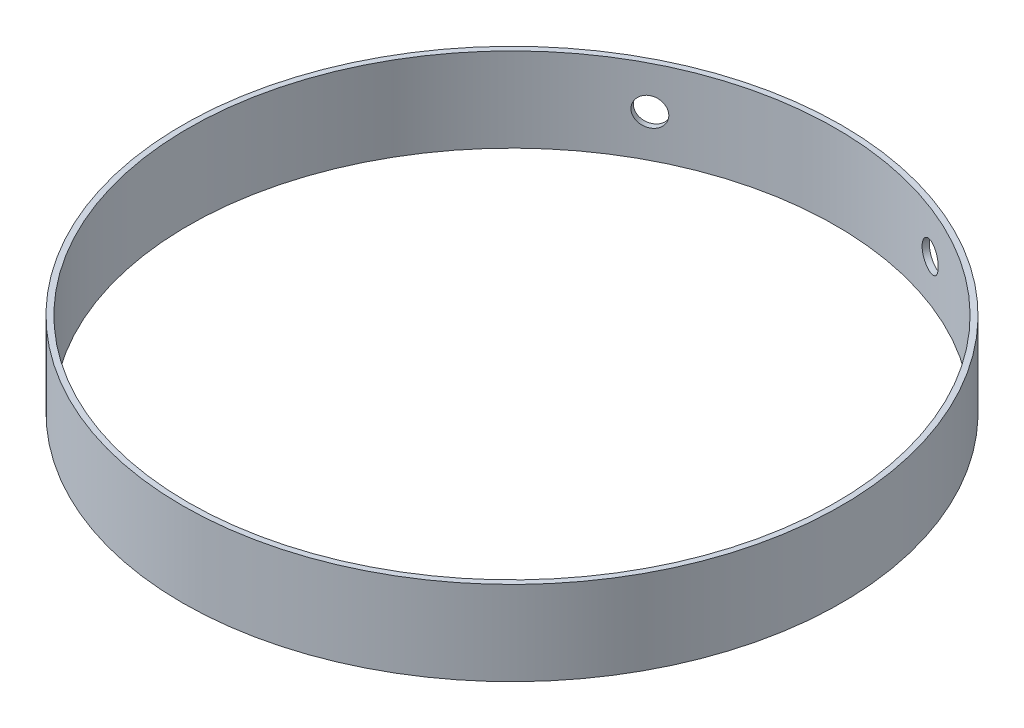
from build123d import *

# Parameters (mm, degrees)
SKETCH1_R                                 = 74.5363
SKETCH1_R_2                               = 73.2663
BOSS_EXTRUDE1_DEPTH                       = 19.05
F_1_4_0_25_DIAMETER_HOLE1_REACH           = 180.162
F_1_4_0_25_DIAMETER_HOLE1_BORE_R          = 3.175
F_1_4_0_25_DIAMETER_HOLE1_ON_FACE_2_REACH = 178.395
F_1_4_0_25_DIAMETER_HOLE1_BORE_2_R        = 3.175


with BuildPart() as part:
    # Sketch1 → Boss-Extrude1 (new body)
    with BuildSketch(Plane(origin=(0, 0, 0), x_dir=(1, 0, 0), z_dir=(0, 1, 0))):
        with Locations(Location((0, 0, 0), (0, 0, 90))):
            Circle(SKETCH1_R)
        with Locations(Location((0, 0, 0), (0, 0, 90))):
            Circle(SKETCH1_R_2, mode=Mode.SUBTRACT)
    extrude(amount=BOSS_EXTRUDE1_DEPTH)

    # 1/4 (0.25) Diameter Hole1 bore (on position points) → 1/4 (0.25) Diameter Hole1 (cut, up to next)
    with BuildSketch(Plane(origin=(-34.380892376, 9.525, -66.133306716), x_dir=(-0.887263074711, 0, 0.461263738283), z_dir=(-0.461263738283, 0, -0.887263074711)), mode=Mode.PRIVATE) as f_1_4_0_25_diameter_hole1_sk1:
        Circle(F_1_4_0_25_DIAMETER_HOLE1_BORE_R)
    f_1_4_0_25_diameter_hole1_tool1 = extrude(f_1_4_0_25_diameter_hole1_sk1.sketch, amount=-F_1_4_0_25_DIAMETER_HOLE1_REACH, mode=Mode.PRIVATE) & part.part
    add(f_1_4_0_25_diameter_hole1_tool1.solids().sort_by_distance((-34.380892, 9.525, -66.133307))[0], mode=Mode.SUBTRACT)

    # 1/4 (0.25) Diameter Hole1 bore 2 (on position points) → 1/4 (0.25) Diameter Hole1 on face 2 (cut, up to next)
    with BuildSketch(Plane(origin=(26.736215839, 9.525, -69.576107827), x_dir=(-0.933452574994, 0, -0.358700836682), z_dir=(0.358700836682, 0, -0.933452574994)), mode=Mode.PRIVATE) as f_1_4_0_25_diameter_hole1_on_face_2_sk1:
        Circle(F_1_4_0_25_DIAMETER_HOLE1_BORE_2_R)
    f_1_4_0_25_diameter_hole1_on_face_2_tool1 = extrude(f_1_4_0_25_diameter_hole1_on_face_2_sk1.sketch, amount=-F_1_4_0_25_DIAMETER_HOLE1_ON_FACE_2_REACH, mode=Mode.PRIVATE) & part.part
    add(f_1_4_0_25_diameter_hole1_on_face_2_tool1.solids().sort_by_distance((26.736216, 9.525, -69.576108))[0], mode=Mode.SUBTRACT)


solid = part.part
